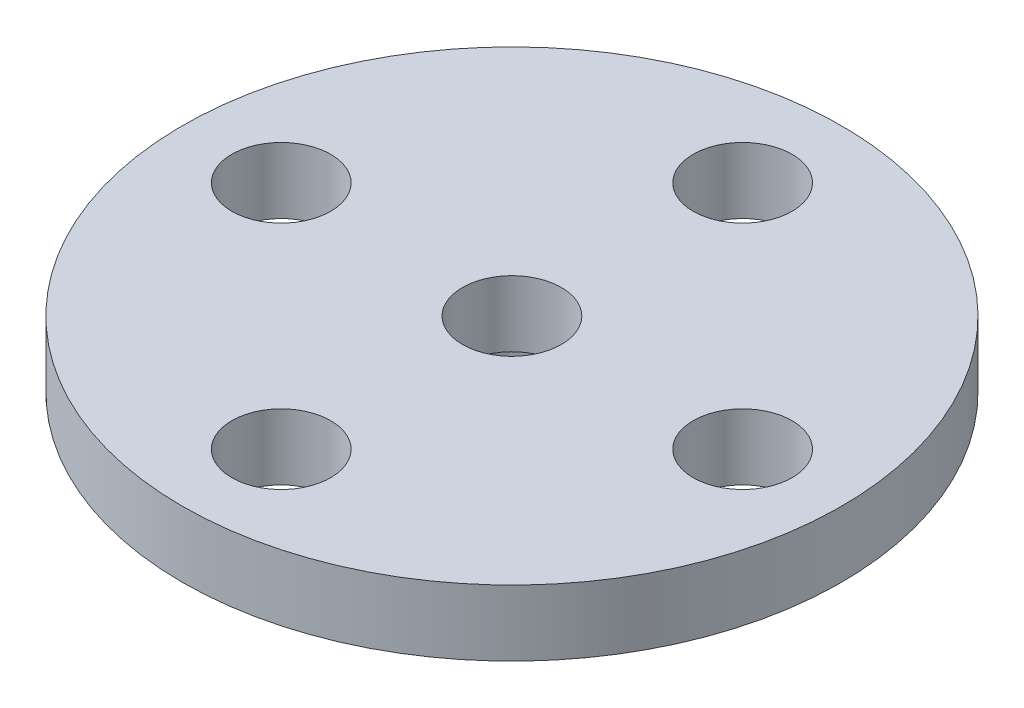
from build123d import *

# Parameters (mm, degrees)
SKETCH_1_R      = 10
SKETCH_1_R_2    = 1.5
EXTRUDE_1_DEPTH = 2
SKETCH_2_R      = 3.203165256
SKETCH_2_R_2    = 2.072813242
EXTRUDE_2_DEPTH = 2.5


with BuildPart() as part:
    # 草图1 → 凸台-拉伸1 (new body)
    with BuildSketch(Plane(origin=(0, 0, 0), x_dir=(1, 0, 0), z_dir=(0, 1, 0))):
        with Locations(Location((0, 0, 0), (0, 0, 270))):
            Circle(SKETCH_1_R)
        with Locations(Location((0, 7, 0), (0, 0, 270))):
            Circle(SKETCH_1_R_2, mode=Mode.SUBTRACT)
        with Locations(Location((7, 0, 0), (0, 0, 270))):
            Circle(SKETCH_1_R_2, mode=Mode.SUBTRACT)
        with Locations(Location((0, -7, 0), (0, 0, 270))):
            Circle(SKETCH_1_R_2, mode=Mode.SUBTRACT)
        with Locations(Location((-7, 0, 0), (0, 0, 270))):
            Circle(SKETCH_1_R_2, mode=Mode.SUBTRACT)
        with Locations(Location((0, 0, 0), (0, 0, 270))):
            Circle(SKETCH_1_R_2, mode=Mode.SUBTRACT)
    extrude(amount=EXTRUDE_1_DEPTH)

    # 草图2 → 凸台-拉伸2 (add)
    with BuildSketch(Plane.XZ):
        with Locations(Location((0, 0, 0), (0, 0, 90))):
            Circle(SKETCH_2_R)
        with Locations(Location((0, 0, 0), (0, 0, 270))):
            Circle(SKETCH_2_R_2, mode=Mode.SUBTRACT)
    extrude(amount=EXTRUDE_2_DEPTH)


solid = part.part
